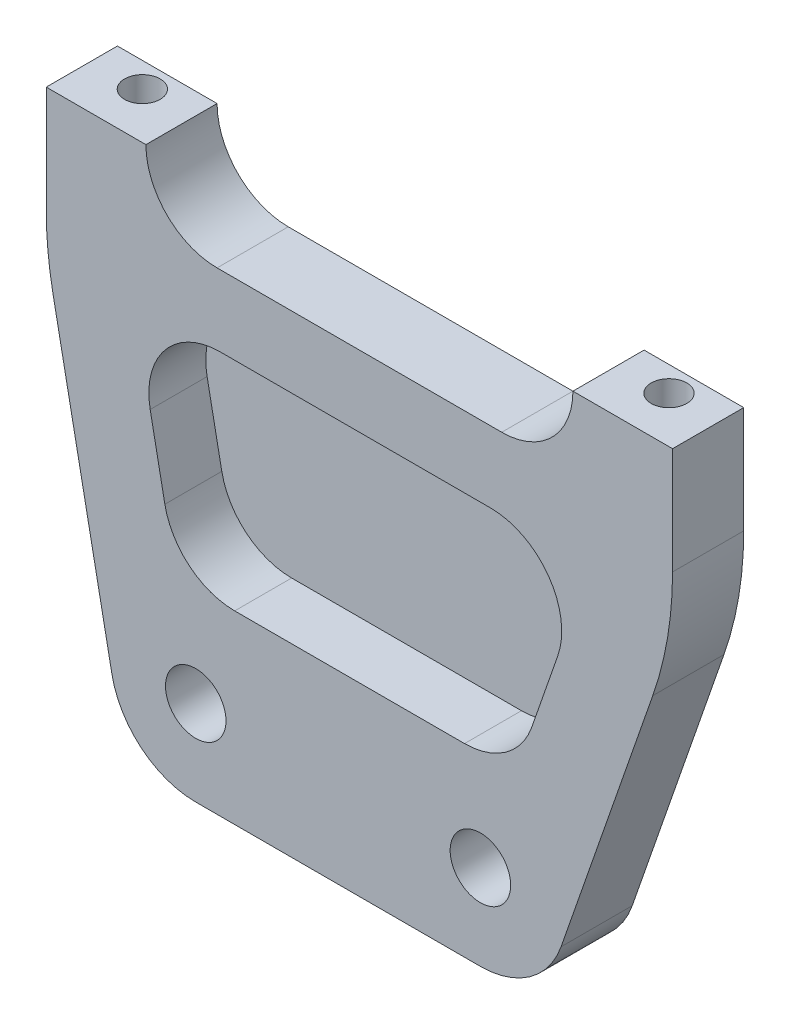
from build123d import *

# Parameters (mm, degrees)
SKETCH1_R                  = 4
BOSS_EXTRUDE1_DEPTH        = 12.7
CUT_EXTRUDE1_DEPTH         = 94.864476774
CUT_EXTRUDE1_DEPTH_BACK    = 94.864476774
SKETCH2_W                  = 2.7
SKETCH2_H                  = 29.5
M6X1_0_TAPPED_HOLE1_D      = 5
M6X1_0_TAPPED_HOLE1_DEPTH  = 15
M6X1_0_TAPPED_HOLE1_TIP    = 1.502151548
BOSS_EXTRUDE2_DEPTH        = 2
M10X1_5_TAPPED_HOLE1_D     = 8.5
M10X1_5_TAPPED_HOLE1_DEPTH = 10
CUT_EXTRUDE2_DEPTH         = 94.864476774
CUT_EXTRUDE2_DEPTH_BACK    = 94.864476774
SKETCH8_OUTSIDE_W          = 38.158
SKETCH8_OUTSIDE_H          = 101.958
SKETCH8_OUTSIDE_W_2        = 10
SKETCH8_OUTSIDE_H_2        = 76.5


with BuildPart() as part:
    # Sketch1 → Boss-Extrude1 (new body)
    with BuildSketch(Plane.XY):
        with BuildLine():
            Line((-21, 64.5), (-7, 64.5))
            ThreePointArc((-7, 64.5), (-4.071067812, 57.428932188), (3, 54.5))
            Line((3, 54.5), (43, 54.5))
            ThreePointArc((43, 54.5), (50.071067812, 57.428932188), (53, 64.5))
            Line((53, 64.5), (67, 64.5))
            Line((67, 64.5), (67, 49.5))
            ThreePointArc((67, 49.5), (66.299754559, 41.161283045), (64.218631982, 33.056132032))
            Line((64.218631982, 33.056132032), (51.332471676, -3.946528312))
            ThreePointArc((51.332471676, -3.946528312), (46.951318589, -9.781572975), (40, -12))
            Line((40, -12), (0, -12))
            ThreePointArc((0, -12), (-7.623489029, -9.26727657), (-11.77483021, -2.313735836))
            Line((-11.77483021, -2.313735836), (-20.061792543, 39.859434015))
            ThreePointArc((-20.061792543, 39.859434015), (-20.764895394, 44.656944514), (-21, 49.5))
            Line((-21, 49.5), (-21, 64.5))
        make_face()
        Circle(SKETCH1_R, mode=Mode.SUBTRACT)
        with Locations((40, 0)):
            Circle(SKETCH1_R, mode=Mode.SUBTRACT)
        with BuildLine():
            Line((-6.400325135, 32.571886803), (-4.337091454, 22.071886803))
            ThreePointArc((-4.337091454, 22.071886803), (-0.87764047, 16.277269525), (5.475267055, 14))
            Line((5.475267055, 14), (37.768949155, 14))
            ThreePointArc((37.768949155, 14), (43.561714646, 15.848689187), (47.212675552, 20.711226406))
            Line((47.212675552, 20.711226406), (50.869295966, 31.211226406))
            ThreePointArc((50.869295966, 31.211226406), (49.576880383, 40.292765491), (41.42556957, 44.5))
            Line((41.42556957, 44.5), (3.412033373, 44.5))
            ThreePointArc((3.412033373, 44.5), (-4.310697101, 40.852907524), (-6.400325135, 32.571886803))
        make_face(mode=Mode.SUBTRACT)
    extrude(amount=BOSS_EXTRUDE1_DEPTH)

    # Sketch2 → Cut-Extrude1 (cut, two sides: drawn at the far end of the back side and taken through both)
    with BuildSketch(Plane(origin=(0, 0, 0), x_dir=(0, 0, -1), z_dir=(1, 0, 0)).offset(-CUT_EXTRUDE1_DEPTH_BACK)):
        with Locations((-11.35, 2.75)):
            Rectangle(SKETCH2_W, SKETCH2_H)
    extrude(amount=CUT_EXTRUDE1_DEPTH + CUT_EXTRUDE1_DEPTH_BACK, mode=Mode.SUBTRACT)

    # M6x1.0 Tapped Hole1
    with Locations(Plane(origin=(0, 64.5, 0), x_dir=(1, 0, 0), z_dir=(0, 1, 0))):
        with Locations((-14, -3.5), (60, -3.5)):
            Hole(M6X1_0_TAPPED_HOLE1_D / 2, depth=M6X1_0_TAPPED_HOLE1_DEPTH)
            with Locations((0, 0, -(M6X1_0_TAPPED_HOLE1_DEPTH + M6X1_0_TAPPED_HOLE1_TIP / 2))):  # 118° drill point
                Cone(0, M6X1_0_TAPPED_HOLE1_D / 2, M6X1_0_TAPPED_HOLE1_TIP, mode=Mode.SUBTRACT)

    # Sketch5 → Boss-Extrude2 (add)
    with BuildSketch(Plane.XY):
        with BuildLine():
            Line((5.475267055, 14), (37.768949155, 14))
            ThreePointArc((37.768949155, 14), (43.561714646, 15.848689187), (47.212675552, 20.711226406))
            Line((47.212675552, 20.711226406), (50.869295966, 31.211226406))
            ThreePointArc((50.869295966, 31.211226406), (49.576880383, 40.292765491), (41.42556957, 44.5))
            Line((41.42556957, 44.5), (3.412033373, 44.5))
            ThreePointArc((3.412033373, 44.5), (-4.310697101, 40.852907524), (-6.400325135, 32.571886803))
            Line((-6.400325135, 32.571886803), (-4.337091454, 22.071886803))
            ThreePointArc((-4.337091454, 22.071886803), (-0.87764047, 16.277269525), (5.475267055, 14))
        make_face()
    extrude(amount=BOSS_EXTRUDE2_DEPTH)

    # M10x1.5 Tapped Hole1
    with Locations(Plane.XY.offset(10)):
        with Locations((0, 0), (40, 0)):
            Hole(M10X1_5_TAPPED_HOLE1_D / 2, depth=M10X1_5_TAPPED_HOLE1_DEPTH)

    # Sketch8 outside → Cut-Extrude2 (cut, two sides: drawn at the far end of the back side and taken through both)
    with BuildSketch(Plane(origin=(0, 0, 0), x_dir=(0, 0, -1), z_dir=(1, 0, 0)).offset(-CUT_EXTRUDE2_DEPTH_BACK)):
        with Locations((-6.35, 26.25)):
            Rectangle(SKETCH8_OUTSIDE_W, SKETCH8_OUTSIDE_H)
        with Locations((-5, 26.25)):
            Rectangle(SKETCH8_OUTSIDE_W_2, SKETCH8_OUTSIDE_H_2, mode=Mode.SUBTRACT)
    extrude(amount=CUT_EXTRUDE2_DEPTH + CUT_EXTRUDE2_DEPTH_BACK, mode=Mode.SUBTRACT)


solid = part.part
